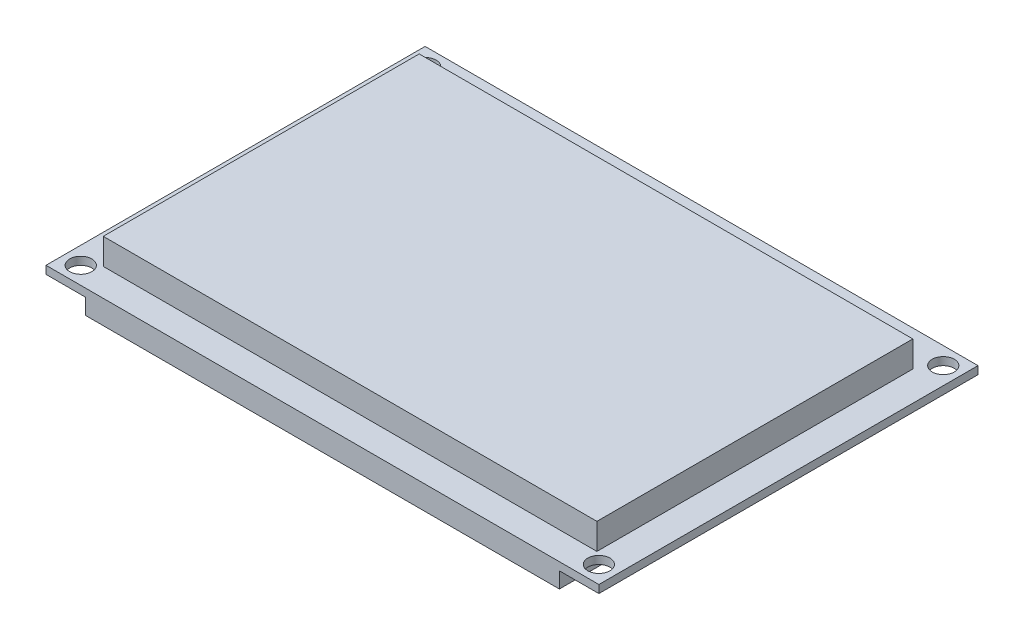
from build123d import *

# Parameters (mm, degrees)
SKETCH1_W           = 70
SKETCH1_H           = 48
SKETCH1_R           = 0.5
SKETCH1_R_2         = 1.4
BOSS_EXTRUDE1_DEPTH = 1
SKETCH2_W           = 62.5
SKETCH2_H           = 40
BOSS_EXTRUDE2_DEPTH = 3.3
SKETCH3_W           = 60
SKETCH3_H           = 43
BOSS_EXTRUDE3_DEPTH = 2


with BuildPart() as part:
    # Sketch1 → Boss-Extrude1 (new body)
    with BuildSketch(Plane(origin=(0, 0, 0), x_dir=(1, 0, 0), z_dir=(0, 1, 0))):
        with Locations((-35, 24)):
            Rectangle(SKETCH1_W, SKETCH1_H)
        with Locations(Location((-68.2, 20.4, 0), (0, 0, 270))):
            Circle(SKETCH1_R, mode=Mode.SUBTRACT)
        with Locations(Location((-68.2, 22.8, 0), (0, 0, 270))):
            Circle(SKETCH1_R, mode=Mode.SUBTRACT)
        with Locations(Location((-68.2, 25.2, 0), (0, 0, 270))):
            Circle(SKETCH1_R, mode=Mode.SUBTRACT)
        with Locations(Location((-68.2, 27.6, 0), (0, 0, 270))):
            Circle(SKETCH1_R, mode=Mode.SUBTRACT)
        with Locations(Location((-31.4, 45.2, 0), (0, 0, 270))):
            Circle(SKETCH1_R, mode=Mode.SUBTRACT)
        with Locations(Location((-33.8, 45.2, 0), (0, 0, 270))):
            Circle(SKETCH1_R, mode=Mode.SUBTRACT)
        with Locations(Location((-36.2, 45.2, 0), (0, 0, 270))):
            Circle(SKETCH1_R, mode=Mode.SUBTRACT)
        with Locations(Location((-38.6, 45.2, 0), (0, 0, 270))):
            Circle(SKETCH1_R, mode=Mode.SUBTRACT)
        with Locations(Location((-67.8, 45.8, 0), (0, 0, 270))):
            Circle(SKETCH1_R_2, mode=Mode.SUBTRACT)
        with Locations(Location((-67.8, 2.2, 0), (0, 0, 270))):
            Circle(SKETCH1_R_2, mode=Mode.SUBTRACT)
        with Locations(Location((-2.2, 2.2, 0), (0, 0, 270))):
            Circle(SKETCH1_R_2, mode=Mode.SUBTRACT)
        with Locations(Location((-2.2, 45.8, 0), (0, 0, 270))):
            Circle(SKETCH1_R_2, mode=Mode.SUBTRACT)
    extrude(amount=BOSS_EXTRUDE1_DEPTH)

    # Sketch2 → Boss-Extrude2 (add)
    with BuildSketch(Plane(origin=(0, 1, 0), x_dir=(1, 0, 0), z_dir=(0, 1, 0))):
        with Locations((-35, 23.5)):
            Rectangle(SKETCH2_W, SKETCH2_H)
    extrude(amount=BOSS_EXTRUDE2_DEPTH)

    # Sketch3 → Boss-Extrude3 (add)
    with BuildSketch(Plane.XZ):
        with Locations((-35, -21.5)):
            Rectangle(SKETCH3_W, SKETCH3_H)
    extrude(amount=BOSS_EXTRUDE3_DEPTH)


solid = part.part
